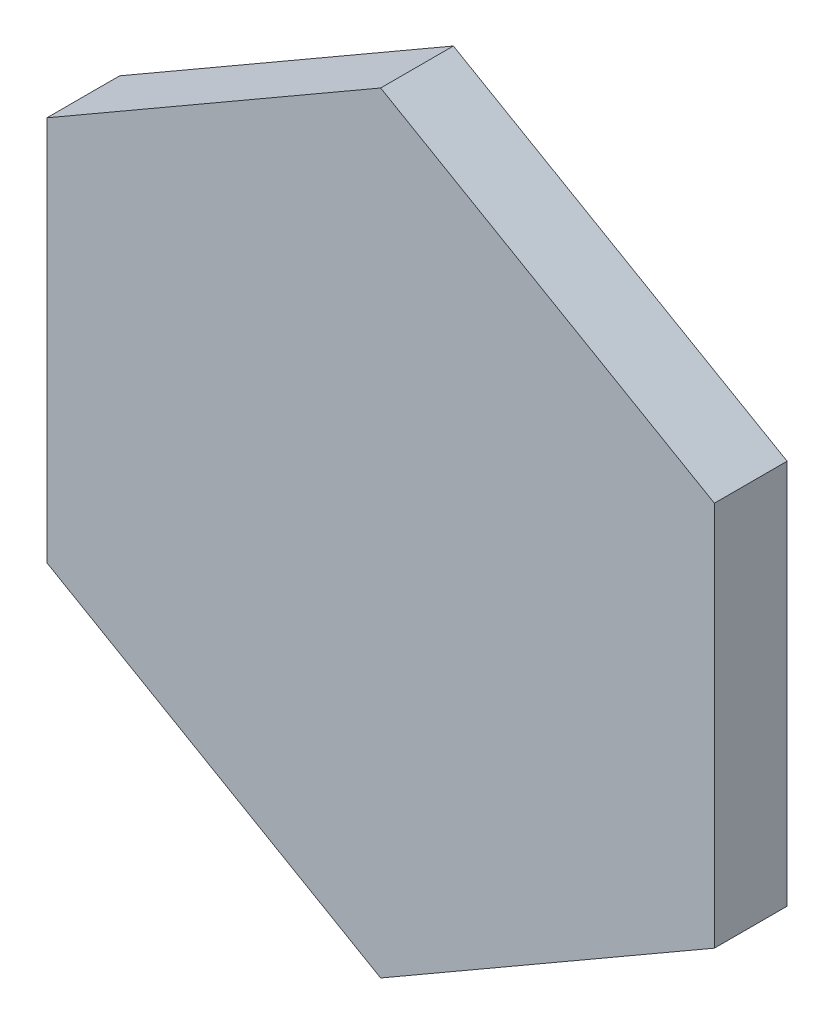
from build123d import *

# Parameters (mm, degrees)
BOSS_EXTRUDE1_DEPTH = 6
BOSS_EXTRUDE2_DEPTH = 0.5


with BuildPart() as part:
    # Sketch1 → Boss-Extrude1 (new body)
    with BuildSketch(Plane.XY):
        Polygon((27.53269207, 15.896007178), (0, 31.792014357), (-27.53269207, 15.896007178), (-27.53269207, -15.896007178), (0, -31.792014357), (27.53269207, -15.896007178), align=None)
    extrude(amount=BOSS_EXTRUDE1_DEPTH)

    # Sketch1<3> → Boss-Extrude2 (add)
    with BuildSketch(Plane.XY):
        Polygon((26.666666667, 15.396007178), (0, 30.792014357), (-26.666666667, 15.396007178), (-26.666666667, -15.396007178), (0, -30.792014357), (26.666666667, -15.396007178), align=None)
        Polygon((12.028130608, 0.833333333), (7.024428275, 0.833333333), (14.24130664, 13.333333333), (18.667658704, 5.666666667), (4.426352064, -19), (-4.426352064, -19), (-18.667658704, 5.666666667), (-14.24130664, 13.333333333), (-7.024428275, 0.833333333), (-12.028130608, 0.833333333), (-11.065880159, -0.833333333), (-6.062177826, -0.833333333), (0, -11.333333333), (6.062177826, -0.833333333), (11.065880159, -0.833333333), align=None, mode=Mode.SUBTRACT)
        Polygon((-15.396007178, 13.333333333), (-19.245008973, 6.666666667), (-23.094010768, 13.333333333), align=None, mode=Mode.SUBTRACT)
        Polygon((0, -9.333333333), (-13.086606102, 13.333333333), (13.086606102, 13.333333333), align=None, mode=Mode.SUBTRACT)
        Polygon((23.094010768, 13.333333333), (19.245008973, 6.666666667), (15.396007178, 13.333333333), align=None, mode=Mode.SUBTRACT)
    extrude(amount=-BOSS_EXTRUDE2_DEPTH)


solid = part.part
